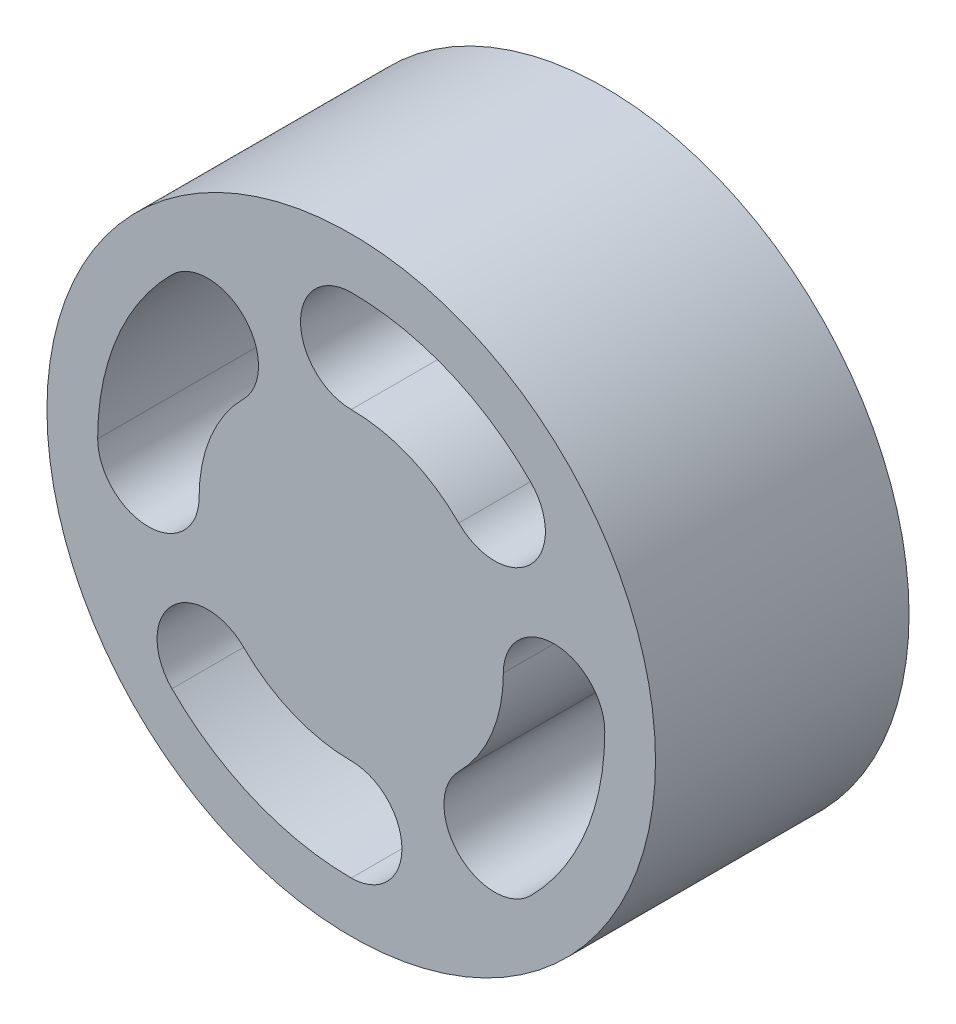
from build123d import *

# Parameters (mm, degrees)
SKETCH_1_R          = 30
EXTRUDE_1_DEPTH     = 25
EXTRUDE_5_DEPTH     = 10
CUT_EXTRUDE_1_REACH = 53.127
SKETCH_4_R          = 1
CUT_EXTRUDE_3_REACH = 51.244


with BuildPart() as part:
    # 草图1 → 凸台-拉伸1 (new body)
    with BuildSketch(Plane.XY):
        Circle(SKETCH_1_R)
    extrude(amount=EXTRUDE_1_DEPTH)

    # 草图2 → 凸台-拉伸5 (add)
    with BuildSketch(Plane.XY):
        with BuildLine():
            ThreePointArc((2.653299832, 1.4), (0, 3), (-2.653299832, 1.4))
            Line((-2.653299832, 1.4), (-1.428285686, 1.4))
            ThreePointArc((-1.428285686, 1.4), (0, 2), (1.428285686, 1.4))
            Line((1.428285686, 1.4), (2.653299832, 1.4))
        make_face()
        with BuildLine():
            Line((-1.428285686, 1.4), (-2.653299832, 1.4))
            ThreePointArc((-2.653299832, 1.4), (-0.721145097, -2.912035327), (3, 0))
            ThreePointArc((3, 0), (2.912035327, 0.721145097), (2.653299832, 1.4))
            Line((2.653299832, 1.4), (1.428285686, 1.4))
            ThreePointArc((1.428285686, 1.4), (1.851563039, 0.756117924), (2, 0))
            ThreePointArc((2, 0), (-0.756117924, -1.851563039), (-1.428285686, 1.4))
        make_face()
        with BuildLine():
            ThreePointArc((1.428285686, 1.4), (0, 2), (-1.428285686, 1.4))
            Line((-1.428285686, 1.4), (0, 1.4))
            Line((0, 1.4), (1.428285686, 1.4))
        make_face()
    extrude(amount=-EXTRUDE_5_DEPTH)

    # 草图4 → 切除-拉伸1 (cut, up to next)
    with BuildSketch(Plane(origin=(0, 3, 0), x_dir=(1, 0, 0), z_dir=(0, 1, 0)), mode=Mode.PRIVATE) as cut_extrude_1_sk1:
        with Locations(Location((0, 7, 0), (0, 0, 270))):
            Circle(SKETCH_4_R)
    cut_extrude_1_tool1 = extrude(cut_extrude_1_sk1.sketch, amount=-CUT_EXTRUDE_1_REACH, mode=Mode.PRIVATE) & part.part
    add(cut_extrude_1_tool1.solids().sort_by_distance((0, 3, -7))[0], mode=Mode.SUBTRACT)

    # 草图6 → 切除-拉伸3 (cut, up to next)
    with BuildSketch(Plane(origin=(0, 0, 0), x_dir=(-1, 0, 0), z_dir=(0, 0, -1)), mode=Mode.PRIVATE) as cut_extrude_3_sk1:
        with BuildLine():
            ThreePointArc((-10.60660171, 10.606601726), (-5.74025148, 13.85819299), (2e-09, 15))
            ThreePointArc((2e-09, 15), (5, 20.000000001), (0, 25))
            ThreePointArc((0, 25), (-9.567085809, 23.096988313), (-17.67766953, 17.67766953))
            ThreePointArc((-17.67766953, 17.67766953), (-17.677669526, 10.606601714), (-10.60660171, 10.606601726))
        make_face()
    cut_extrude_3_tool1 = extrude(cut_extrude_3_sk1.sketch, amount=-CUT_EXTRUDE_3_REACH, mode=Mode.PRIVATE) & part.part
    # 草图6 → 切除-拉伸3 (cut, up to next)
    with BuildSketch(Plane(origin=(0, 0, 0), x_dir=(-1, 0, 0), z_dir=(0, 0, -1)), mode=Mode.PRIVATE) as cut_extrude_3_sk2:
        with BuildLine():
            ThreePointArc((10.606601688, 10.606601748), (13.858192979, 5.740251505), (15, 0))
            ThreePointArc((15, 0), (20, -5), (25, 0))
            ThreePointArc((25, 0), (23.096988313, 9.567085809), (17.67766953, 17.67766953))
            ThreePointArc((17.67766953, 17.67766953), (10.606601733, 17.677669545), (10.606601688, 10.606601748))
        make_face()
    cut_extrude_3_tool2 = extrude(cut_extrude_3_sk2.sketch, amount=-CUT_EXTRUDE_3_REACH, mode=Mode.PRIVATE) & part.part
    # 草图6 → 切除-拉伸3 (cut, up to next)
    with BuildSketch(Plane(origin=(0, 0, 0), x_dir=(-1, 0, 0), z_dir=(0, 0, -1)), mode=Mode.PRIVATE) as cut_extrude_3_sk3:
        with BuildLine():
            ThreePointArc((-15, 0), (-19.999999994, 5), (-25, 1.2e-08))
            ThreePointArc((-25, 1.2e-08), (-23.096988305, -9.567085829), (-17.67766949, -17.677669569))
            ThreePointArc((-17.67766949, -17.677669569), (-10.606601708, -17.677669519), (-10.606601699, -10.606601737))
            ThreePointArc((-10.606601699, -10.606601737), (-13.858192983, -5.740251498), (-15, 0))
        make_face()
    cut_extrude_3_tool3 = extrude(cut_extrude_3_sk3.sketch, amount=-CUT_EXTRUDE_3_REACH, mode=Mode.PRIVATE) & part.part
    # 草图6 → 切除-拉伸3 (cut, up to next)
    with BuildSketch(Plane(origin=(0, 0, 0), x_dir=(-1, 0, 0), z_dir=(0, 0, -1)), mode=Mode.PRIVATE) as cut_extrude_3_sk4:
        with BuildLine():
            ThreePointArc((10.606601737, -10.606601699), (5.740251492, -13.858192985), (-1.3e-08, -15))
            ThreePointArc((-1.3e-08, -15), (-5, -19.999999976), (-6e-08, -25))
            ThreePointArc((-6e-08, -25), (9.567085826, -23.096988306), (17.677669598, -17.677669461))
            ThreePointArc((17.677669598, -17.677669461), (17.677669505, -10.606601693), (10.606601737, -10.606601699))
        make_face()
    cut_extrude_3_tool4 = extrude(cut_extrude_3_sk4.sketch, amount=-CUT_EXTRUDE_3_REACH, mode=Mode.PRIVATE) & part.part
    add(cut_extrude_3_tool1.solids().sort_by_distance((7.329332, 17.694573, 0))[0], mode=Mode.SUBTRACT)
    add(cut_extrude_3_tool2.solids().sort_by_distance((-17.694573, 7.329332, 0))[0], mode=Mode.SUBTRACT)
    add(cut_extrude_3_tool3.solids().sort_by_distance((17.694573, -7.329332, 0))[0], mode=Mode.SUBTRACT)
    add(cut_extrude_3_tool4.solids().sort_by_distance((-7.329332, -17.694573, 0))[0], mode=Mode.SUBTRACT)


solid = part.part
